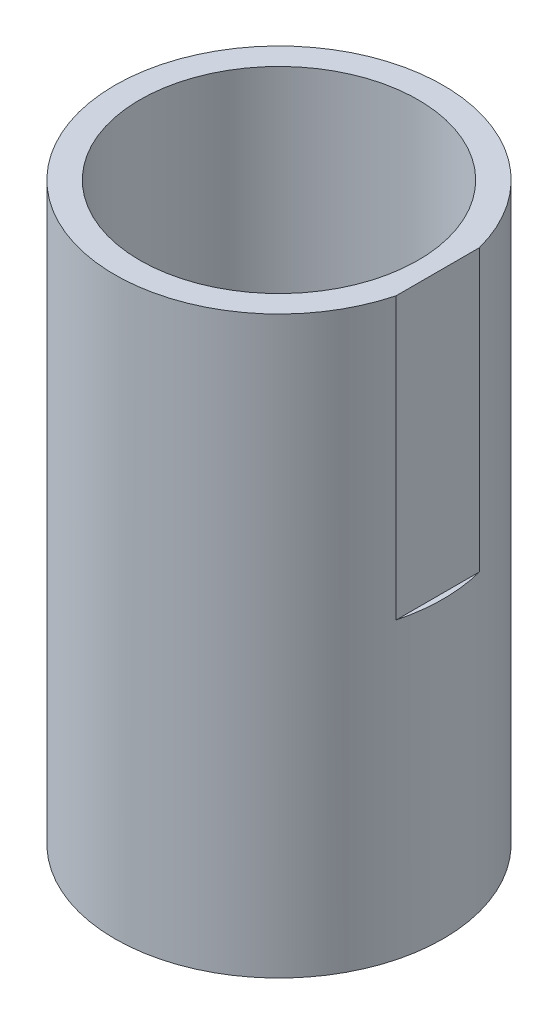
from build123d import *

# Parameters (mm, degrees)
SKETCH1_R           = 24.13
SKETCH1_R_2         = 20.447
BOSS_EXTRUDE1_DEPTH = 42.2656
SKETCH2_W           = 12.7
SKETCH2_H           = 41.275
CUT_EXTRUDE1_DEPTH  = 0.7874


with BuildPart() as part:
    # Sketch1 → Boss-Extrude1 (new, symmetric)
    with BuildSketch(Plane(origin=(0, 0, 0), x_dir=(1, 0, 0), z_dir=(0, 1, 0))):
        with Locations(Location((0, 0, 0), (0, 0, 270))):
            Circle(SKETCH1_R)
        with Locations(Location((0, 0, 0), (0, 0, 270))):
            Circle(SKETCH1_R_2, mode=Mode.SUBTRACT)
    extrude(amount=BOSS_EXTRUDE1_DEPTH, both=True)

    # Sketch2 → Cut-Extrude1 (cut)
    with BuildSketch(Plane(origin=(24.13, 0, 0), x_dir=(0, 0, -1), z_dir=(1, 0, 0))):
        with Locations((0, 21.6281)):
            Rectangle(SKETCH2_W, SKETCH2_H)
    extrude(amount=-CUT_EXTRUDE1_DEPTH, mode=Mode.SUBTRACT)


solid = part.part
